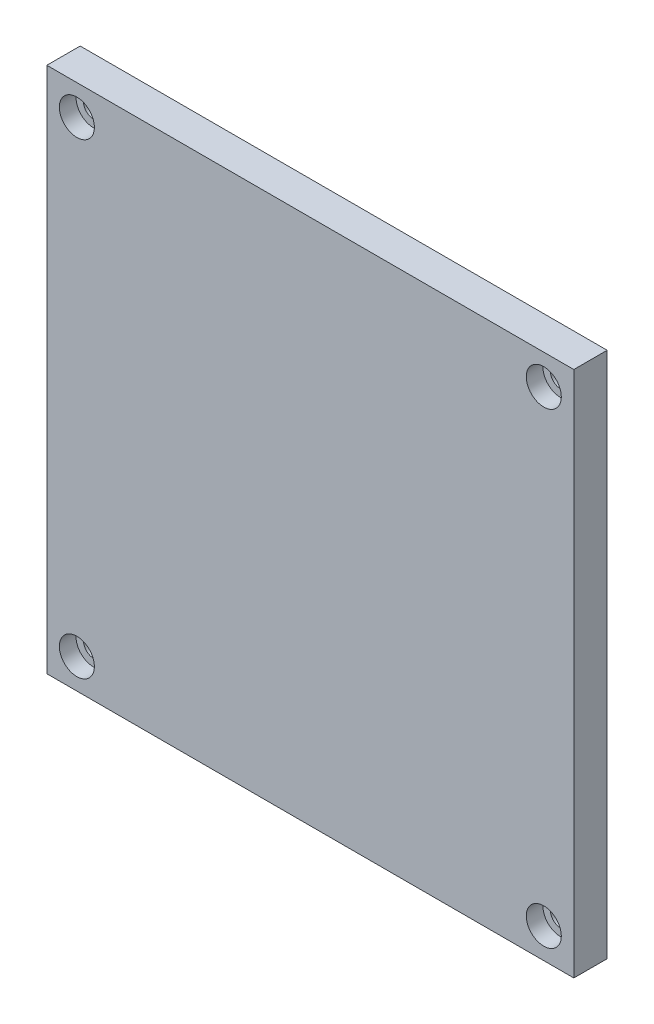
from build123d import *

# Parameters (mm, degrees)
SKETCH1_W           = 81.28
SKETCH1_H           = 81.28
SKETCH1_R           = 1.524
BOSS_EXTRUDE1_DEPTH = 5.08
SKETCH2_R           = 2.667
CUT_EXTRUDE1_DEPTH  = 2.54
SKETCH3_W           = 81.28
SKETCH3_H           = 81.28
SKETCH3_W_2         = 80.264
SKETCH3_H_2         = 80.264
CUT_EXTRUDE2_DEPTH  = 74.813116721


with BuildPart() as part:
    # Sketch1 → Boss-Extrude1 (new body)
    with BuildSketch(Plane.XY):
        with Locations((-11.43, 11.43)):
            Rectangle(SKETCH1_W, SKETCH1_H)
        with Locations(Location((-46.99, 46.99, 0), (0, 0, 180))):
            Circle(SKETCH1_R, mode=Mode.SUBTRACT)
        with Locations(Location((-46.99, -24.13, 0), (0, 0, 180))):
            Circle(SKETCH1_R, mode=Mode.SUBTRACT)
        with Locations(Location((24.13, -24.13, 0), (0, 0, 180))):
            Circle(SKETCH1_R, mode=Mode.SUBTRACT)
        with Locations(Location((24.13, 46.99, 0), (0, 0, 180))):
            Circle(SKETCH1_R, mode=Mode.SUBTRACT)
    extrude(amount=BOSS_EXTRUDE1_DEPTH)

    # Sketch2 → Cut-Extrude1 (cut)
    with BuildSketch(Plane.XY.offset(5.08)):
        with Locations((-46.99, -24.13)):
            Circle(SKETCH2_R)
        with Locations((-46.99, 46.99)):
            Circle(SKETCH2_R)
        with Locations((24.13, 46.99)):
            Circle(SKETCH2_R)
        with Locations((24.13, -24.13)):
            Circle(SKETCH2_R)
    extrude(amount=-CUT_EXTRUDE1_DEPTH, mode=Mode.SUBTRACT)

    # Sketch3 → Cut-Extrude2 (cut, through all)
    with BuildSketch(Plane.XY.offset(5.08)):
        with Locations((-11.43, 11.43)):
            Rectangle(SKETCH3_W, SKETCH3_H)
        with Locations((-11.43, 11.43)):
            Rectangle(SKETCH3_W_2, SKETCH3_H_2, mode=Mode.SUBTRACT)
    extrude(amount=-CUT_EXTRUDE2_DEPTH, mode=Mode.SUBTRACT)


solid = part.part
